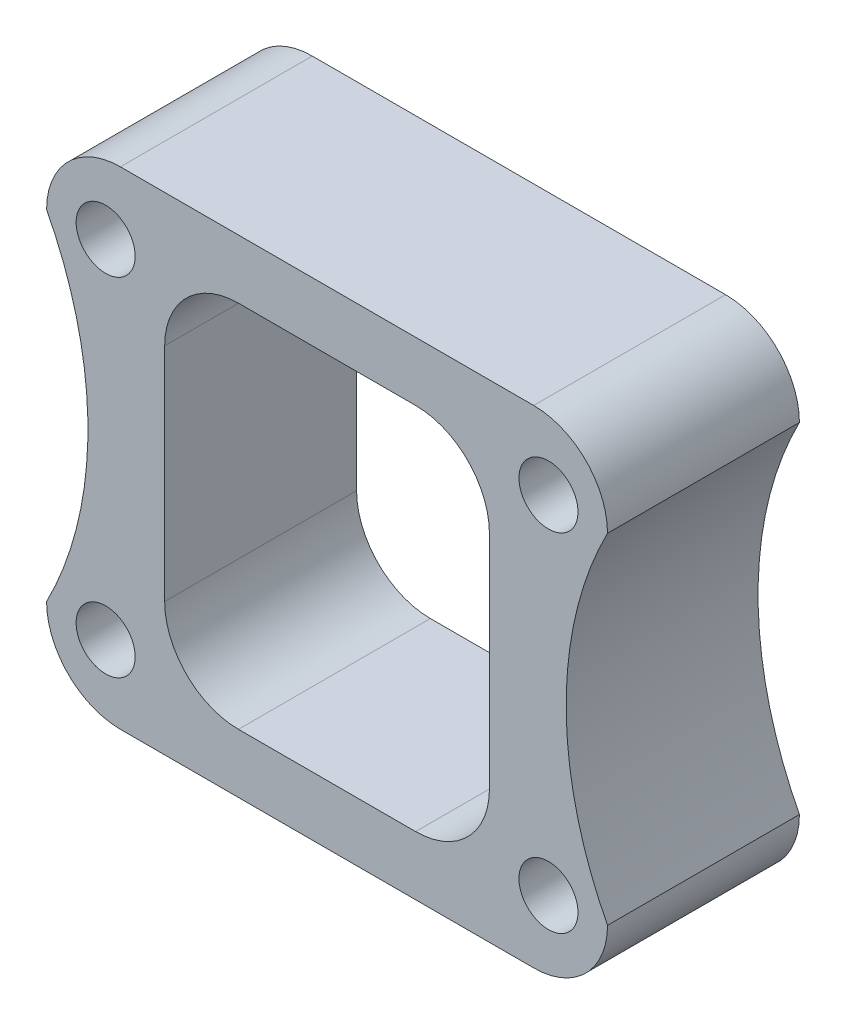
from build123d import *

# Parameters (mm, degrees)
CROQUIS1_R              = 2
SALIENTE_EXTRUIR1_DEPTH = 13
CROQUIS2_W              = 22
CROQUIS2_H              = 25
CORTAR_EXTRUIR1_DEPTH   = 52.980765673
REDONDEO1_R             = 5


with BuildPart() as part:
    # Croquis1 → Saliente-Extruir1 (new body)
    with BuildSketch(Plane.XY):
        with BuildLine():
            Line((5, 0), (33, 0))
            ThreePointArc((33, 0), (36.535533906, 1.464466094), (38, 5))
            ThreePointArc((38, 5), (35.19797288, 16.5), (38, 28))
            ThreePointArc((38, 28), (36.535533906, 31.535533906), (33, 33))
            Line((33, 33), (5, 33))
            ThreePointArc((5, 33), (1.464466094, 31.535533906), (0, 28))
            ThreePointArc((0, 28), (2.80202712, 16.5), (0, 5))
            ThreePointArc((0, 5), (1.464466094, 1.464466094), (5, 0))
        make_face()
        with Locations(Location((4, 4.75, 0), (0, 0, 180))):
            Circle(CROQUIS1_R, mode=Mode.SUBTRACT)
        with Locations(Location((34, 4.75, 0), (0, 0, 180))):
            Circle(CROQUIS1_R, mode=Mode.SUBTRACT)
        with Locations(Location((34, 28.25, 0), (0, 0, 180))):
            Circle(CROQUIS1_R, mode=Mode.SUBTRACT)
        with Locations(Location((4, 28.25, 0), (0, 0, 180))):
            Circle(CROQUIS1_R, mode=Mode.SUBTRACT)
    extrude(amount=SALIENTE_EXTRUIR1_DEPTH)

    # Croquis2 → Cortar-Extruir1 (cut, through all)
    with BuildSketch(Plane(origin=(0, 0, 0), x_dir=(-1, 0, 0), z_dir=(0, 0, -1))):
        with Locations((-19, 16.5)):
            Rectangle(CROQUIS2_W, CROQUIS2_H)
    extrude(amount=-CORTAR_EXTRUIR1_DEPTH, mode=Mode.SUBTRACT)

    # Redondeo1
    redondeo1_edges = [part.edges().sort_by_distance(p)[0] for p in [
        (8, 4, 6.5),
        (30, 4, 6.5),
        (30, 29, 6.5),
        (8, 29, 6.5),
    ]]
    fillet(redondeo1_edges, radius=REDONDEO1_R)


solid = part.part
